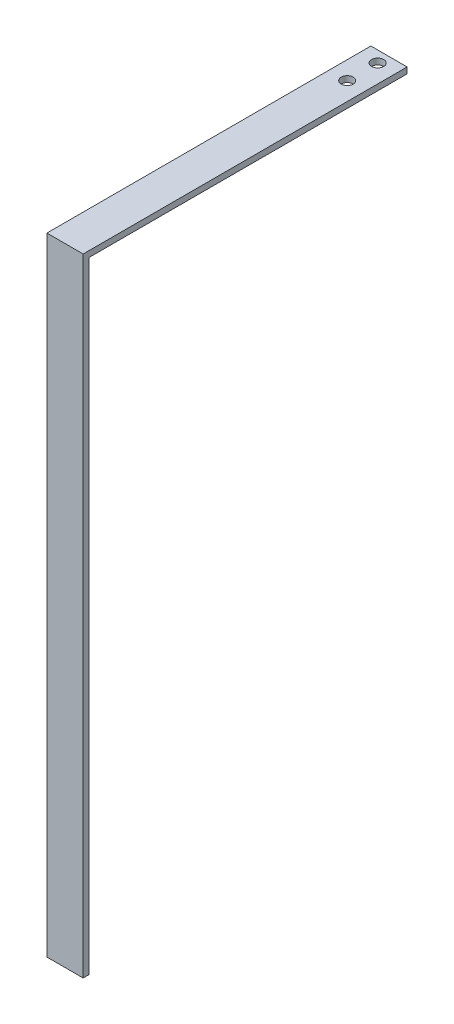
from build123d import *

# Parameters (mm, degrees)
CROQUIS1_W              = 38.1
CROQUIS1_H              = 6.31
SALIENTE_EXTRUIR1_DEPTH = 340.39
CROQUIS3_W              = 38.1
CROQUIS3_H              = 6.31
SALIENTE_EXTRUIR2_DEPTH = 652.48
CROQUIS5_R              = 6.35
CORTAR_EXTRUIR1_DEPTH   = 6.31


with BuildPart() as part:
    # Croquis1 → Saliente-Extruir1 (new body)
    with BuildSketch(Plane.XY):
        Rectangle(CROQUIS1_W, CROQUIS1_H)
    extrude(amount=SALIENTE_EXTRUIR1_DEPTH)

    # Croquis3 → Saliente-Extruir2 (add)
    with BuildSketch(Plane.XZ.offset(3.155)):
        with Locations((0, 337.235)):
            Rectangle(CROQUIS3_W, CROQUIS3_H)
    extrude(amount=SALIENTE_EXTRUIR2_DEPTH)

    # Croquis5 → Cortar-Extruir1 (cut)
    with BuildSketch(Plane(origin=(0, 3.155, 0), x_dir=(1, 0, 0), z_dir=(0, 1, 0))):
        with Locations(Location((0, -43.892204666, 0), (0, 0, 270))):
            Circle(CROQUIS5_R)
        with Locations(Location((0, -11.892204666, 0), (0, 0, 270))):
            Circle(CROQUIS5_R)
    extrude(amount=-CORTAR_EXTRUIR1_DEPTH, mode=Mode.SUBTRACT)


solid = part.part
